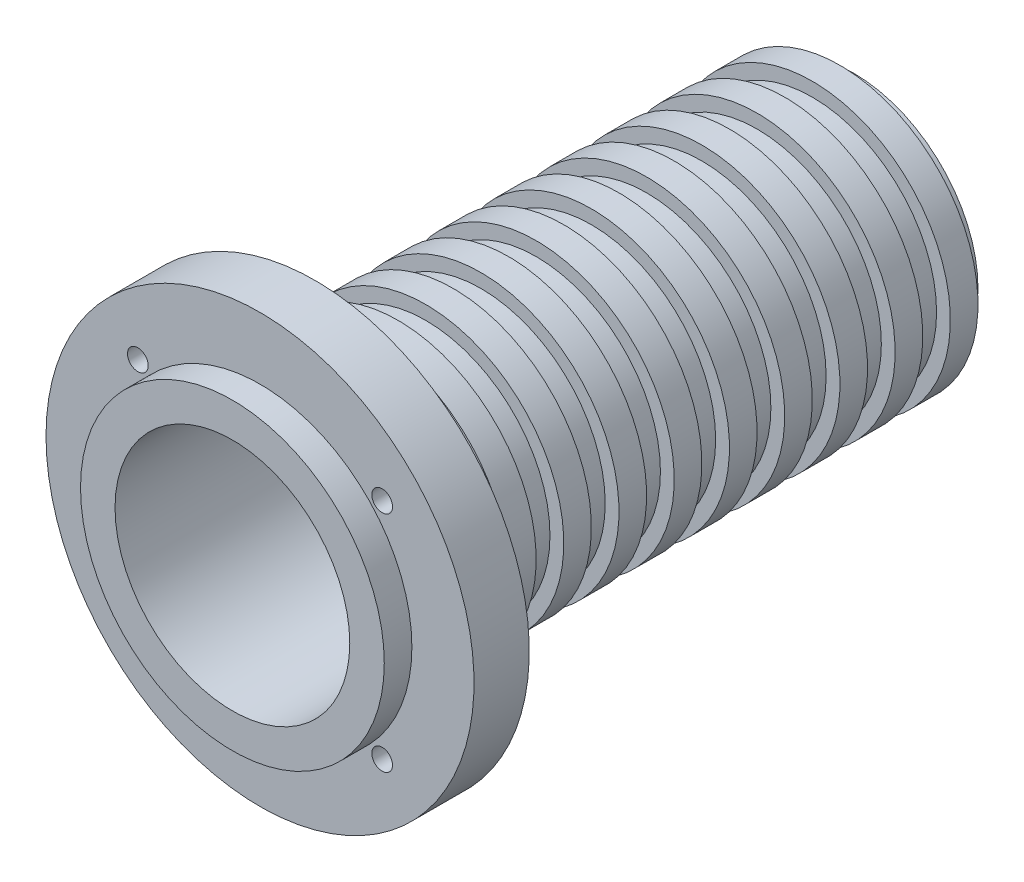
from build123d import *

# Parameters (mm, degrees)
SKETCH1_R           = 22
BOSS_EXTRUDE1_DEPTH = 4
SKETCH2_R           = 31
BOSS_EXTRUDE2_DEPTH = 8
SKETCH3_R           = 1.5
CUT_EXTRUDE1_DEPTH  = 46.453272709
SKETCH4_R           = 18
BOSS_EXTRUDE3_DEPTH = 78
SKETCH5_R           = 17
CUT_EXTRUDE2_DEPTH  = 101.109939566
SKETCH6_R           = 20
SKETCH6_R_2         = 18
BOSS_EXTRUDE4_DEPTH = 4
LPATTERN1_COUNT     = 10
LPATTERN1_PITCH     = 8


with BuildPart() as part:
    # Sketch1 → Boss-Extrude1 (new body)
    with BuildSketch(Plane.XY):
        Circle(SKETCH1_R)
    extrude(amount=BOSS_EXTRUDE1_DEPTH)

    # Sketch2 → Boss-Extrude2 (add)
    with BuildSketch(Plane(origin=(0, 0, 0), x_dir=(-1, 0, 0), z_dir=(0, 0, -1))):
        Circle(SKETCH2_R)
    extrude(amount=BOSS_EXTRUDE2_DEPTH)

    # Sketch3 → Cut-Extrude1 (cut, through all)
    with BuildSketch(Plane(origin=(0, 0, -8), x_dir=(-1, 0, 0), z_dir=(0, 0, -1))):
        with Locations((-17.695427462, 16.213323131)):
            Circle(SKETCH3_R)
        with Locations((17.695427462, 16.213323131)):
            Circle(SKETCH3_R)
        with Locations((17.695427462, -16.213323131)):
            Circle(SKETCH3_R)
        with Locations((-17.695427462, -16.213323131)):
            Circle(SKETCH3_R)
    extrude(amount=-CUT_EXTRUDE1_DEPTH, mode=Mode.SUBTRACT)

    # Sketch4 → Boss-Extrude3 (add)
    with BuildSketch(Plane(origin=(0, 0, -8), x_dir=(-1, 0, 0), z_dir=(0, 0, -1))):
        Circle(SKETCH4_R)
    extrude(amount=BOSS_EXTRUDE3_DEPTH)

    # Sketch5 → Cut-Extrude2 (cut, through all)
    with BuildSketch(Plane(origin=(0, 0, -86), x_dir=(-1, 0, 0), z_dir=(0, 0, -1))):
        Circle(SKETCH5_R)
    extrude(amount=-CUT_EXTRUDE2_DEPTH, mode=Mode.SUBTRACT)

    # Sketch6 → Boss-Extrude4 (add)
    with BuildSketch(Plane(origin=(0, 0, -8), x_dir=(-1, 0, 0), z_dir=(0, 0, -1))):
        Circle(SKETCH6_R)
        Circle(SKETCH6_R_2, mode=Mode.SUBTRACT)
    boss_extrude4 = extrude(amount=BOSS_EXTRUDE4_DEPTH)

    # LPattern1: Boss-Extrude4 ×10
    with Locations(*[(0, 0, -i * LPATTERN1_PITCH) for i in range(1, LPATTERN1_COUNT)]):
        add(boss_extrude4)


solid = part.part
